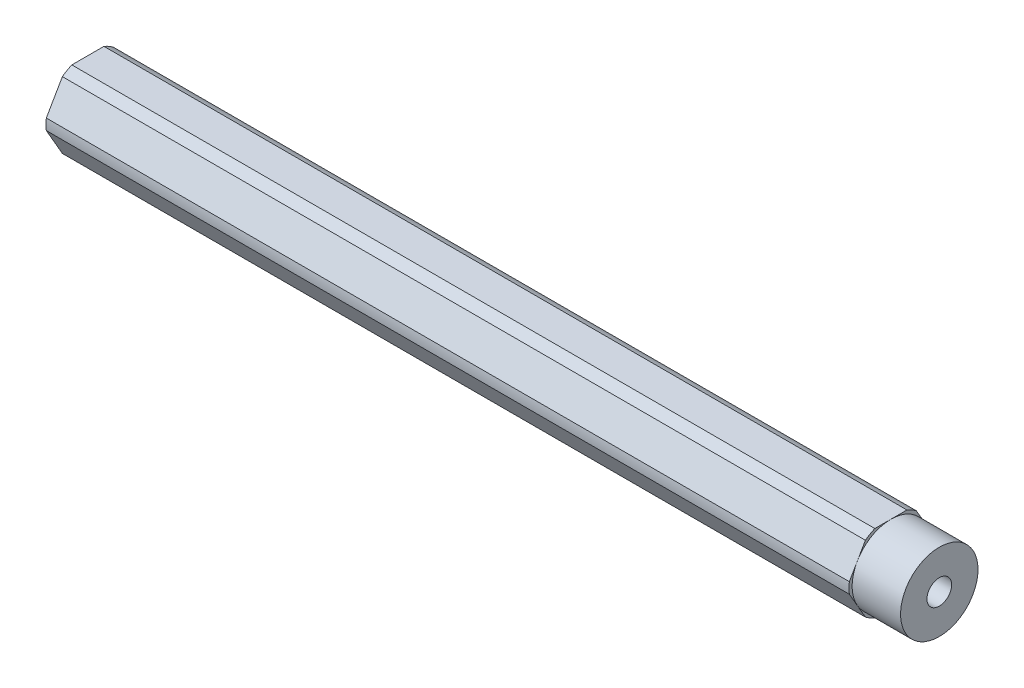
from build123d import *

# Parameters (mm, degrees)
SKETCH1_R                            = 2.0193
BOSS_EXTRUDE1_DEPTH                  = 69.8246
F_10_32_TAPPED_HOLE1_D               = 4.0386
F_10_32_TAPPED_HOLE1_DEPTH           = 16.34744
F_10_32_TAPPED_HOLE1_TIP             = 1.213317848
F_10_32_TAPPED_HOLE1_ON_FACE_2_D     = 4.0386
F_10_32_TAPPED_HOLE1_ON_FACE_2_DEPTH = 16.34744
F_10_32_TAPPED_HOLE1_ON_FACE_2_TIP   = 1.213317848
SKETCH3_R                            = 8.89
SKETCH3_R_2                          = 6.35
CUT_EXTRUDE_THIN1_DEPTH              = 7.9375


with BuildPart() as part:
    # Sketch1 → Boss-Extrude1 (new, symmetric)
    with BuildSketch(Plane(origin=(0, 0, 0), x_dir=(0, 0, -1), z_dir=(1, 0, 0))):
        with BuildLine():
            ThreePointArc((4.181770846, 5.456960429), (3.437499983, 5.953924622), (2.634980936, 6.35))
            Line((2.634980936, 6.35), (-2.634980936, 6.35))
            ThreePointArc((-2.634980936, 6.35), (-3.437499983, 5.953924622), (-4.181770846, 5.456960429))
            Line((-4.181770846, 5.456960429), (-6.816751782, 0.893039571))
            ThreePointArc((-6.816751782, 0.893039571), (-6.874999966, 0), (-6.816751782, -0.893039571))
            Line((-6.816751782, -0.893039571), (-4.181770846, -5.456960429))
            ThreePointArc((-4.181770846, -5.456960429), (-3.437499983, -5.953924622), (-2.634980936, -6.35))
            Line((-2.634980936, -6.35), (2.634980936, -6.35))
            ThreePointArc((2.634980936, -6.35), (3.437499983, -5.953924622), (4.181770846, -5.456960429))
            Line((4.181770846, -5.456960429), (6.816751782, -0.893039571))
            ThreePointArc((6.816751782, -0.893039571), (6.860422465, -0.447468582), (6.874999966, 0))
            ThreePointArc((6.874999966, 0), (6.860422465, 0.447468582), (6.816751782, 0.893039571))
            Line((6.816751782, 0.893039571), (4.181770846, 5.456960429))
        make_face()
        Circle(SKETCH1_R, mode=Mode.SUBTRACT)
    extrude(amount=BOSS_EXTRUDE1_DEPTH, both=True)

    # #10-32 Tapped Hole1
    with Locations(Plane(origin=(69.8246, 0, 0), x_dir=(0, 0, 1), z_dir=(1, 0, 0))):
        with Locations((0, 0)):
            Hole(F_10_32_TAPPED_HOLE1_D / 2, depth=F_10_32_TAPPED_HOLE1_DEPTH)
            with Locations((0, 0, -(F_10_32_TAPPED_HOLE1_DEPTH + F_10_32_TAPPED_HOLE1_TIP / 2))):  # 118° drill point
                Cone(0, F_10_32_TAPPED_HOLE1_D / 2, F_10_32_TAPPED_HOLE1_TIP, mode=Mode.SUBTRACT)

    # #10-32 Tapped Hole1 on face 2
    with Locations(Plane(origin=(-69.8246, 0, 0), x_dir=(0, 0, 1), z_dir=(1, 0, 0))):
        with Locations((0, 0)):
            Hole(F_10_32_TAPPED_HOLE1_ON_FACE_2_D / 2, depth=F_10_32_TAPPED_HOLE1_ON_FACE_2_DEPTH)
            with Locations((0, 0, -(F_10_32_TAPPED_HOLE1_ON_FACE_2_DEPTH + F_10_32_TAPPED_HOLE1_ON_FACE_2_TIP / 2))):  # 118° drill point
                Cone(0, F_10_32_TAPPED_HOLE1_ON_FACE_2_D / 2, F_10_32_TAPPED_HOLE1_ON_FACE_2_TIP, mode=Mode.SUBTRACT)

    # Sketch3 → Cut-Extrude-Thin1 (cut)
    with BuildSketch(Plane(origin=(69.8246, 0, 0), x_dir=(0, 0, -1), z_dir=(1, 0, 0))):
        Circle(SKETCH3_R)
        Circle(SKETCH3_R_2, mode=Mode.SUBTRACT)
    extrude(amount=-CUT_EXTRUDE_THIN1_DEPTH, mode=Mode.SUBTRACT)


solid = part.part
